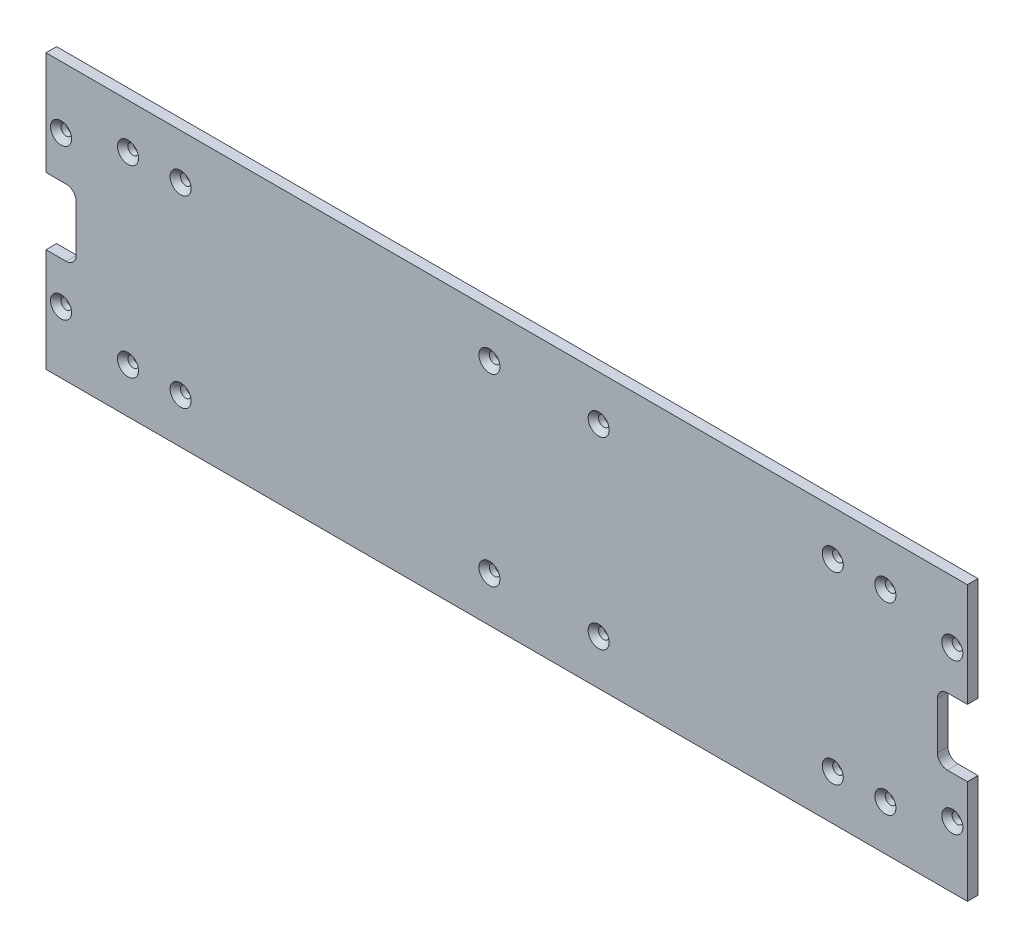
from build123d import *

# Parameters (mm, degrees)
BOSS_EXTRU_1_DEPTH                             = 3.175
FRAISAGE_POUR_VIS_T_TE_FRAIS_E_M31_D           = 3.2
FRAISAGE_POUR_VIS_T_TE_FRAIS_E_M31_CSINK_D     = 6.3
FRAISAGE_POUR_VIS_T_TE_FRAIS_E_M31_CSINK_ANGLE = 90
FRAISAGE_POUR_VIS_T_TE_FRAIS_E_M32_D           = 3.2
FRAISAGE_POUR_VIS_T_TE_FRAIS_E_M32_CSINK_D     = 6.3
FRAISAGE_POUR_VIS_T_TE_FRAIS_E_M32_CSINK_ANGLE = 90
CONG_1_R                                       = 3


with BuildPart() as part:
    # Esquisse1 → Boss.-Extru.1 (new body)
    with BuildSketch(Plane.XY):
        Polygon((-262.5, 10), (-262.5, 41), (13, 41), (13, 10), (4, 10), (4, -10), (13, -10), (13, -41), (-262.5, -41), (-262.5, -10), (-253.5, -10), (-253.5, 10), align=None)
    extrude(amount=BOSS_EXTRU_1_DEPTH)

    # Fraisage pour vis à tête fraisée M31 (through all)
    with Locations(Plane.XY.offset(3.175)):
        with Locations((-11.515, 27.5), (-11.515, -27.5), (-237.985, -27.5), (-237.985, 27.5), (-27.25, 27.5), (-27.25, -27.5), (-222.25, -27.5), (-222.25, 27.5), (-97.25, 27.5), (-97.25, -27.5), (-129.905, 27.5), (-129.905, -27.5)):
            CounterSinkHole(FRAISAGE_POUR_VIS_T_TE_FRAIS_E_M31_D / 2, FRAISAGE_POUR_VIS_T_TE_FRAIS_E_M31_CSINK_D / 2, counter_sink_angle=FRAISAGE_POUR_VIS_T_TE_FRAIS_E_M31_CSINK_ANGLE)

    # Fraisage pour vis à tête fraisée M32 (through all)
    with Locations(Plane.XY.offset(3.175)):
        with Locations((8.5, -22.5), (8.5, 22.5), (-258, -22.5), (-258, 22.5)):
            CounterSinkHole(FRAISAGE_POUR_VIS_T_TE_FRAIS_E_M32_D / 2, FRAISAGE_POUR_VIS_T_TE_FRAIS_E_M32_CSINK_D / 2, counter_sink_angle=FRAISAGE_POUR_VIS_T_TE_FRAIS_E_M32_CSINK_ANGLE)

    # Congé1
    cong_1_edges = [part.edges().sort_by_distance(p)[0] for p in [
        (-253.5, -10, 1.5875),
        (-253.5, 10, 1.5875),
        (4, 10, 1.5875),
        (4, -10, 1.5875),
    ]]
    fillet(cong_1_edges, radius=CONG_1_R)


solid = part.part
